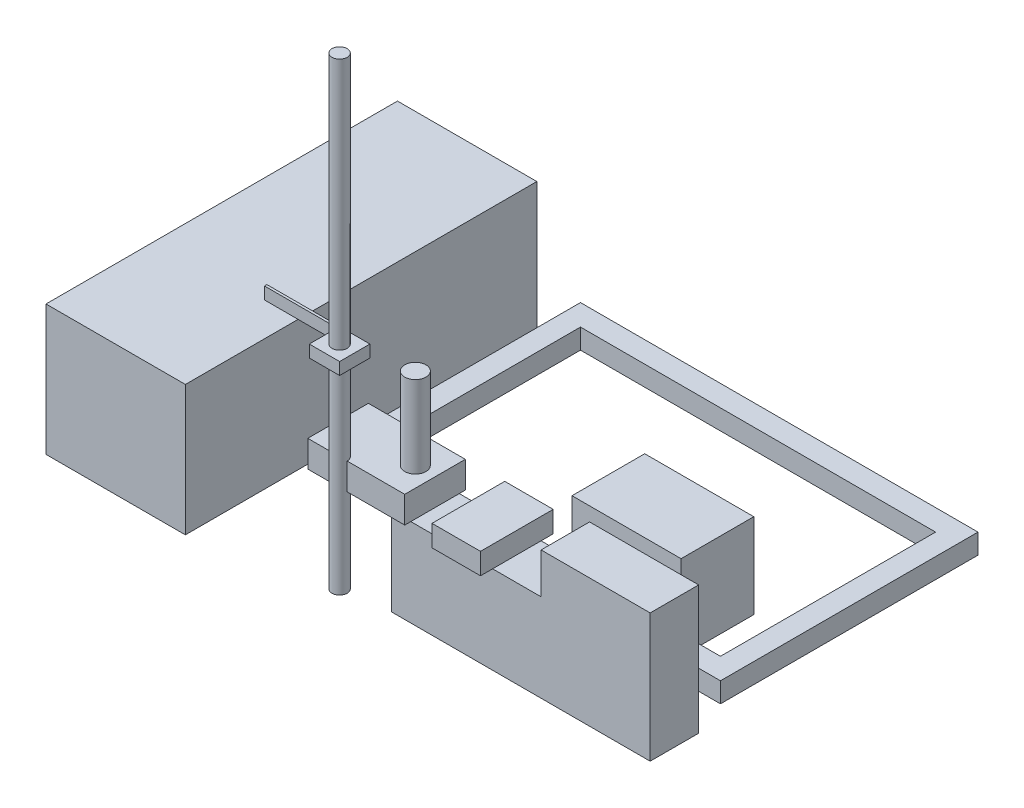
from build123d import *

# Parameters (mm, degrees)
SKETCH1_W            = 656
SKETCH1_H            = 425
SKETCH1_W_2          = 586
SKETCH1_H_2          = 355
BOSS_EXTRUDE1_DEPTH  = 33
SKETCH2_W            = 180
SKETCH2_H            = 120
BOSS_EXTRUDE2_DEPTH  = 140
SKETCH4_W            = 426.5
SKETCH4_H            = 80
BOSS_EXTRUDE3_DEPTH  = 145
SKETCH5_W            = 180
SKETCH5_H            = 80
BOSS_EXTRUDE4_DEPTH  = 67
SKETCH6_W            = 80
SKETCH6_H            = 120
BOSS_EXTRUDE5_DEPTH  = 35
SKETCH7_W            = 160
SKETCH7_H            = 100
BOSS_EXTRUDE6_DEPTH  = 44
SKETCH8_R            = 17.5
BOSS_EXTRUDE7_DEPTH  = 135
SKETCH10_W           = 230
SKETCH10_H           = 580
BOSS_EXTRUDE8_DEPTH  = 215
SKETCH9_R            = 12.5
BOSS_EXTRUDE9_DEPTH  = 766
SKETCH11_W           = 50
SKETCH11_H           = 50
SKETCH11_R           = 12.5
BOSS_EXTRUDE10_DEPTH = 20
SKETCH12_W           = 170
SKETCH12_H           = 20
BOSS_EXTRUDE11_DEPTH = 4


with BuildPart() as part:
    # Sketch1 → Boss-Extrude1 (new body)
    with BuildSketch(Plane(origin=(0, 0, 0), x_dir=(1, 0, 0), z_dir=(0, 1, 0))):
        Rectangle(SKETCH1_W, SKETCH1_H)
        Rectangle(SKETCH1_W_2, SKETCH1_H_2, mode=Mode.SUBTRACT)
    extrude(amount=BOSS_EXTRUDE1_DEPTH)

    # Sketch2 → Boss-Extrude2 (add)
    with BuildSketch(Plane(origin=(0, 0, 0), x_dir=(1, 0, 0), z_dir=(0, 1, 0))):
        with Locations((138, -117.5)):
            Rectangle(SKETCH2_W, SKETCH2_H)
    extrude(amount=BOSS_EXTRUDE2_DEPTH)


with BuildPart() as body_2:
    # Sketch4 → Boss-Extrude3 (new body)
    with BuildSketch(Plane(origin=(0, 0, 0), x_dir=(1, 0, 0), z_dir=(0, 1, 0))):
        with Locations((138.75, -312.5)):
            Rectangle(SKETCH4_W, SKETCH4_H)
    extrude(amount=BOSS_EXTRUDE3_DEPTH)

    # Sketch5 → Boss-Extrude4 (add)
    with BuildSketch(Plane(origin=(0, 145, 0), x_dir=(1, 0, 0), z_dir=(0, 1, 0))):
        with Locations((262, -312.5)):
            Rectangle(SKETCH5_W, SKETCH5_H)
    extrude(amount=BOSS_EXTRUDE4_DEPTH)

    # Sketch6 → Boss-Extrude5 (add)
    with BuildSketch(Plane(origin=(0, 145, 0), x_dir=(1, 0, 0), z_dir=(0, 1, 0))):
        with Locations((52, -312.5)):
            Rectangle(SKETCH6_W, SKETCH6_H)
    extrude(amount=BOSS_EXTRUDE5_DEPTH)

    # Sketch7 → Boss-Extrude6 (add)
    with BuildSketch(Plane(origin=(0, 145, 0), x_dir=(1, 0, 0), z_dir=(0, 1, 0))):
        with Locations((-123, -312.5)):
            Rectangle(SKETCH7_W, SKETCH7_H)
    extrude(amount=BOSS_EXTRUDE6_DEPTH)

    # Sketch8 → Boss-Extrude7 (add)
    with BuildSketch(Plane(origin=(0, 189, 0), x_dir=(1, 0, 0), z_dir=(0, 1, 0))):
        with Locations((-75.5, -312.5)):
            Circle(SKETCH8_R)
    extrude(amount=BOSS_EXTRUDE7_DEPTH)

    # Sketch9 → Boss-Extrude9 (add)
    with BuildSketch(Plane(origin=(0, 0, 0), x_dir=(1, 0, 0), z_dir=(0, 1, 0))):
        with Locations((-150.5, -362.5)):
            Circle(SKETCH9_R)
    extrude(amount=BOSS_EXTRUDE9_DEPTH)

    # Sketch11 → Boss-Extrude10 (add)
    with BuildSketch(Plane(origin=(0, 330, 0), x_dir=(1, 0, 0), z_dir=(0, 1, 0))):
        with Locations((-150.5, -362.5)):
            Rectangle(SKETCH11_W, SKETCH11_H)
        with Locations((-150.5, -362.5)):
            Circle(SKETCH11_R, mode=Mode.SUBTRACT)
    extrude(amount=BOSS_EXTRUDE10_DEPTH)

    # Sketch12 → Boss-Extrude11 (add)
    with BuildSketch(Plane(origin=(0, 0, 337.5), x_dir=(-1, 0, 0), z_dir=(0, 0, -1))):
        with Locations((210.5, 340)):
            Rectangle(SKETCH12_W, SKETCH12_H)
    extrude(amount=-BOSS_EXTRUDE11_DEPTH)


with BuildPart() as body_3:
    # Sketch10 → Boss-Extrude8 (new body)
    with BuildSketch(Plane(origin=(0, 0, 0), x_dir=(1, 0, 0), z_dir=(0, 1, 0))):
        with Locations((-470, -122.5)):
            Rectangle(SKETCH10_W, SKETCH10_H)
    extrude(amount=BOSS_EXTRUDE8_DEPTH)


solid = Compound([part.part, body_2.part, body_3.part])
